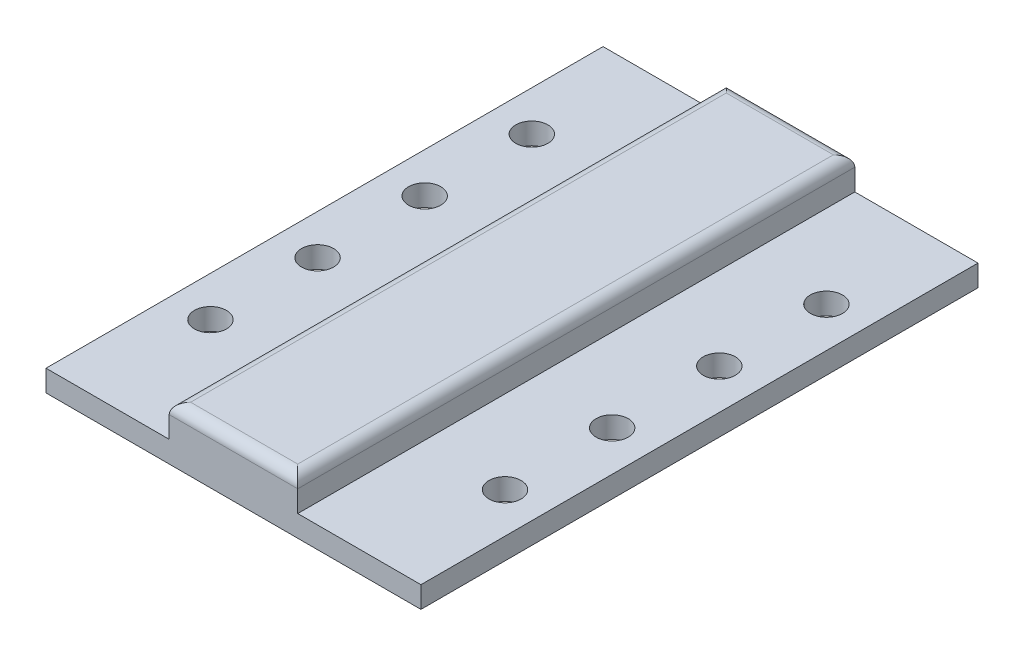
from build123d import *

# Parameters (mm, degrees)
SKETCH_1_W                  = 35
SKETCH_1_H                  = 52
EXTRUDE_1_DEPTH             = 2
EXTRUDE_2_REACH             = 33.405
SKETCH_2_W                  = 12
SKETCH_2_H                  = 3
EXTRUDE_2_DIRECTION_2_REACH = 33.405
SKETCH_3_R                  = 1.5
CUT_EXTRUDE_1_DEPTH         = 10
FILLET_1_R                  = 1


with BuildPart() as part:
    # Эскиз1 → Бобышка-Вытянуть1 (new body)
    with BuildSketch(Plane(origin=(0, 0, 0), x_dir=(1, 0, 0), z_dir=(0, 1, 0))):
        Rectangle(SKETCH_1_W, SKETCH_1_H)
    extrude(amount=EXTRUDE_1_DEPTH)

    # Бобышка-Вытянуть2: up to this face of the body (flat: up to its plane)
    extrude_2_end = Plane(part.part.faces().sort_by_distance((0, 1, 26))[0])
    # Эскиз2 → Бобышка-Вытянуть2 (add, up to the picked face)
    with BuildSketch(Plane.XY, mode=Mode.PRIVATE) as extrude_2_sk1:
        with Locations((0, 3.5)):
            Rectangle(SKETCH_2_W, SKETCH_2_H)
    extrude_2_tool1 = split(extrude(extrude_2_sk1.sketch, amount=EXTRUDE_2_REACH, mode=Mode.PRIVATE), bisect_by=extrude_2_end, keep=Keep.BOTH, mode=Mode.PRIVATE)
    add(extrude_2_tool1.solids().sort_by(Axis((0, 3.5, 0), (0, 0, 1)))[0])

    # Бобышка-Вытянуть2 direction 2: up to this face of the body (flat: up to its plane)
    extrude_2_direction_2_end = Plane(part.part.faces().sort_by_distance((0, 1, -26))[0])
    # Эскиз2 → Бобышка-Вытянуть2 direction 2 (add, up to the picked face)
    with BuildSketch(Plane.XY, mode=Mode.PRIVATE) as extrude_2_direction_2_sk1:
        with Locations((0, 3.5)):
            Rectangle(SKETCH_2_W, SKETCH_2_H)
    extrude_2_direction_2_tool1 = split(extrude(extrude_2_direction_2_sk1.sketch, amount=-EXTRUDE_2_DIRECTION_2_REACH, mode=Mode.PRIVATE), bisect_by=extrude_2_direction_2_end, keep=Keep.BOTH, mode=Mode.PRIVATE)
    add(extrude_2_direction_2_tool1.solids().sort_by(Axis((0, 3.5, 0), (0, 0, -1)))[0])

    # Эскиз3 → Вырез-Вытянуть1 (cut)
    with BuildSketch(Plane(origin=(0, 2, 0), x_dir=(1, 0, 0), z_dir=(0, 1, 0))):
        with Locations(Location((13.75, 15.6, 0), (0, 0, 270))):
            Circle(SKETCH_3_R)
        with Locations(Location((-13.75, 15.6, 0), (0, 0, 270))):
            Circle(SKETCH_3_R)
        with Locations(Location((-13.75, 5.6, 0), (0, 0, 270))):
            Circle(SKETCH_3_R)
        with Locations(Location((13.75, 5.6, 0), (0, 0, 270))):
            Circle(SKETCH_3_R)
        with Locations(Location((-13.75, -4.4, 0), (0, 0, 270))):
            Circle(SKETCH_3_R)
        with Locations(Location((13.75, -4.4, 0), (0, 0, 270))):
            Circle(SKETCH_3_R)
        with Locations(Location((-13.75, -14.4, 0), (0, 0, 270))):
            Circle(SKETCH_3_R)
        with Locations(Location((13.75, -14.4, 0), (0, 0, 270))):
            Circle(SKETCH_3_R)
    extrude(amount=-CUT_EXTRUDE_1_DEPTH, mode=Mode.SUBTRACT)

    # Скругление1
    fillet_1_edges = [part.edges().sort_by_distance(p)[0] for p in [
        (0, 5, 26),
        (6, 5, 0),
        (-6, 5, 0),
        (0, 5, -26),
    ]]
    fillet(fillet_1_edges, radius=FILLET_1_R)


solid = part.part
